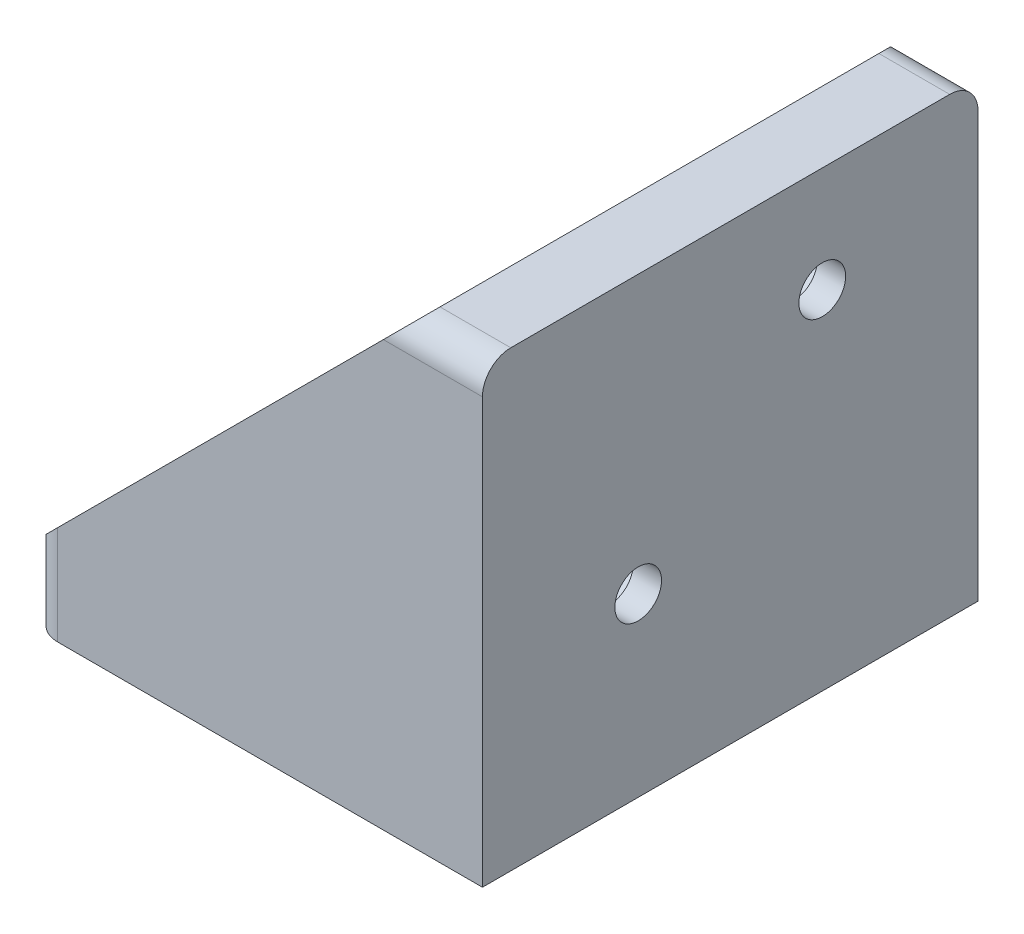
from build123d import *

# Parameters (mm, degrees)
EXTRUDE_1_DEPTH     = 35
RIB_1_REACH         = 59.21
SKETCH_3_WALL_W     = 154.604044108
SKETCH_3_WALL_H     = 3
CUT_EXTRUDE_1_DEPTH = 3
SKETCH_6_R          = 1.65
CUT_EXTRUDE_2_DEPTH = 8
CUT_EXTRUDE_3_DEPTH = 3
SKETCH_8_R          = 1.65
CUT_EXTRUDE_4_DEPTH = 10
FILLET_1_R          = 2


with BuildPart() as part:
    # Эскиз1 → Бобышка-Вытянуть1 (new body)
    with BuildSketch(Plane.XY):
        Polygon((0, 0), (-32, 0), (-32, 5), (-5, 5), (-5, 32), (0, 32), align=None)
    extrude(amount=EXTRUDE_1_DEPTH)

    # Эскиз3 wall → Ребро1 (add, up to next)
    with BuildSketch(Plane(origin=(-18.5, 18.5, 35), x_dir=(0.707106781187, 0.707106781187, 0), z_dir=(-0.707106781187, 0.707106781187, 0)), mode=Mode.PRIVATE) as rib_1_sk1:
        with Locations((0, 1.5)):
            Rectangle(SKETCH_3_WALL_W, SKETCH_3_WALL_H)
    rib_1_tool1 = extrude(rib_1_sk1.sketch, amount=-RIB_1_REACH, mode=Mode.PRIVATE) - part.part
    rib_1 = rib_1_tool1.solids().sort_by_distance((-18.5, 18.5, 35))[0]
    add(rib_1)

    # Зеркальное отражение1: Ребро1 across plane
    add(rib_1.mirror(Plane.XY.offset(17.5)))

    # Эскиз5 → Вырез-Вытянуть1 (cut)
    with BuildSketch(Plane.ZY.offset(5)):
        Polygon((24, 8.984174247), (27, 10.716225055), (27, 14.18032667), (24, 15.912377477), (21, 14.18032667), (21, 10.716225055), align=None)
        Polygon((11, 21.087622523), (14, 22.81967333), (14, 26.283774945), (11, 28.015825753), (8, 26.283774945), (8, 22.81967333), align=None)
    extrude(amount=-CUT_EXTRUDE_1_DEPTH, mode=Mode.SUBTRACT)

    # Эскиз6 → Вырез-Вытянуть2 (cut)
    with BuildSketch(Plane.ZY.offset(2)):
        with Locations((11, 24.551724138)):
            Circle(SKETCH_6_R)
        with Locations((24, 12.448275862)):
            Circle(SKETCH_6_R)
    extrude(amount=-CUT_EXTRUDE_2_DEPTH, mode=Mode.SUBTRACT)

    # Эскиз7 → Вырез-Вытянуть3 (cut)
    with BuildSketch(Plane(origin=(0, 5, 0), x_dir=(1, 0, 0), z_dir=(0, 1, 0))):
        Polygon((-24.551724138, -20.535898385), (-27.551724138, -22.267949192), (-27.551724138, -25.732050808), (-24.551724138, -27.464101615), (-21.551724138, -25.732050808), (-21.551724138, -22.267949192), align=None)
        Polygon((-12.448275862, -7.535898385), (-15.448275862, -9.267949192), (-15.448275862, -12.732050808), (-12.448275862, -14.464101615), (-9.448275862, -12.732050808), (-9.448275862, -9.267949192), align=None)
    extrude(amount=-CUT_EXTRUDE_3_DEPTH, mode=Mode.SUBTRACT)

    # Эскиз8 → Вырез-Вытянуть4 (cut)
    with BuildSketch(Plane(origin=(0, 2, 0), x_dir=(1, 0, 0), z_dir=(0, 1, 0))):
        with Locations(Location((-24.551724138, -24, 0), (0, 0, 270))):
            Circle(SKETCH_8_R)
        with Locations(Location((-12.448275862, -11, 0), (0, 0, 270))):
            Circle(SKETCH_8_R)
    extrude(amount=-CUT_EXTRUDE_4_DEPTH, mode=Mode.SUBTRACT)

    # Скругление1
    fillet_1_edges = [part.edges().sort_by_distance(p)[0] for p in [
        (-32, 2.5, 35),
        (-32, 2.5, 0),
        (-2.5, 32, 0),
        (-2.5, 32, 35),
    ]]
    fillet(fillet_1_edges, radius=FILLET_1_R)


solid = part.part
